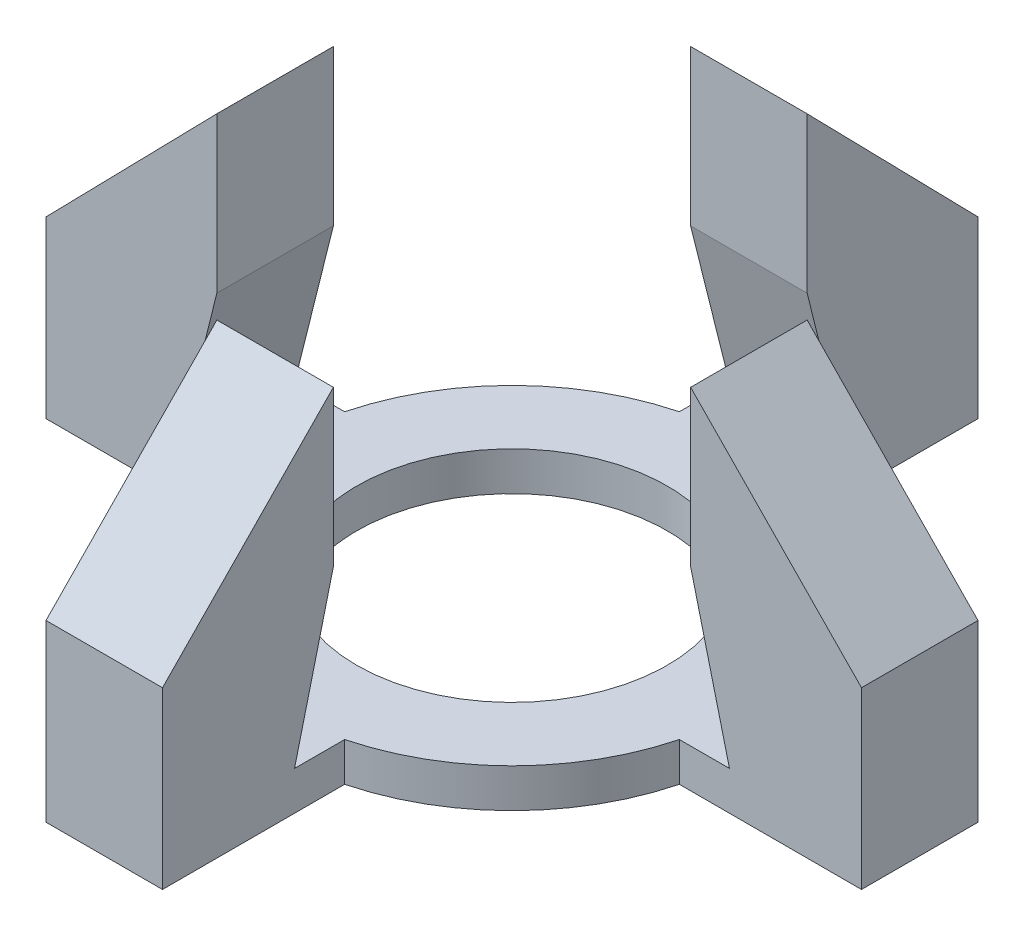
from build123d import *

# Parameters (mm, degrees)
EXTRUDE_1_DEPTH     = 5
SKETCH_4_W          = 22
SKETCH_4_H          = 15
SKETCH_4_W_2        = 15
SKETCH_4_H_2        = 22
EXTRUDE_3_DEPTH     = 40
CUT_EXTRUDE_1_REACH = 93.549
CUT_EXTRUDE_2_REACH = 93.549
CUT_EXTRUDE_3_REACH = 93.549
CUT_EXTRUDE_4_REACH = 93.549


with BuildPart() as part:
    # 草图1 → 凸台-拉伸1 (new body)
    with BuildSketch(Plane(origin=(0, 0, 0), x_dir=(1, 0, 0), z_dir=(0, 1, 0))):
        with BuildLine():
            ThreePointArc((29.047375097, 7.5), (21.213203436, 21.213203436), (7.5, 29.047375097))
            Line((7.5, 29.047375097), (7.5, 18.540496218))
            ThreePointArc((7.5, 18.540496218), (14.142135624, 14.142135624), (18.540496218, 7.5))
            Line((18.540496218, 7.5), (29.047375097, 7.5))
        make_face()
        with BuildLine():
            ThreePointArc((30, 0), (29.760890888, 3.780128774), (29.047375097, 7.5))
            Line((29.047375097, 7.5), (18.540496218, 7.5))
            ThreePointArc((18.540496218, 7.5), (19.63173355, 3.820345249), (20, 0))
            ThreePointArc((20, 0), (19.63173355, -3.820345249), (18.540496218, -7.5))
            Line((18.540496218, -7.5), (29.047375097, -7.5))
            ThreePointArc((29.047375097, -7.5), (29.760890888, -3.780128774), (30, 0))
        make_face()
        with BuildLine():
            Line((52.5, 7.5), (29.047375097, 7.5))
            ThreePointArc((29.047375097, 7.5), (29.760890888, 3.780128774), (30, 0))
            ThreePointArc((30, 0), (29.760890888, -3.780128774), (29.047375097, -7.5))
            Line((29.047375097, -7.5), (52.5, -7.5))
            Line((52.5, -7.5), (52.5, 7.5))
        make_face()
        with BuildLine():
            ThreePointArc((7.5, -29.047375097), (21.213203436, -21.213203436), (29.047375097, -7.5))
            Line((29.047375097, -7.5), (18.540496218, -7.5))
            ThreePointArc((18.540496218, -7.5), (14.142135624, -14.142135624), (7.5, -18.540496218))
            Line((7.5, -18.540496218), (7.5, -29.047375097))
        make_face()
        with BuildLine():
            ThreePointArc((7.5, -29.047375097), (0, -30), (-7.5, -29.047375097))
            Line((-7.5, -29.047375097), (-7.5, -52.5))
            Line((-7.5, -52.5), (7.5, -52.5))
            Line((7.5, -52.5), (7.5, -29.047375097))
        make_face()
        with BuildLine():
            Line((-7.5, -18.540496218), (-7.5, -29.047375097))
            ThreePointArc((-7.5, -29.047375097), (0, -30), (7.5, -29.047375097))
            Line((7.5, -29.047375097), (7.5, -18.540496218))
            ThreePointArc((7.5, -18.540496218), (0, -20), (-7.5, -18.540496218))
        make_face()
        with BuildLine():
            Line((-18.540496218, -7.5), (-29.047375097, -7.5))
            ThreePointArc((-29.047375097, -7.5), (-21.213203436, -21.213203436), (-7.5, -29.047375097))
            Line((-7.5, -29.047375097), (-7.5, -18.540496218))
            ThreePointArc((-7.5, -18.540496218), (-14.142135624, -14.142135624), (-18.540496218, -7.5))
        make_face()
        with BuildLine():
            Line((-18.540496218, 7.5), (-29.047375097, 7.5))
            ThreePointArc((-29.047375097, 7.5), (-30, 0), (-29.047375097, -7.5))
            Line((-29.047375097, -7.5), (-18.540496218, -7.5))
            ThreePointArc((-18.540496218, -7.5), (-20, 0), (-18.540496218, 7.5))
        make_face()
        with BuildLine():
            ThreePointArc((-29.047375097, -7.5), (-30, 0), (-29.047375097, 7.5))
            Line((-29.047375097, 7.5), (-52.5, 7.5))
            Line((-52.5, 7.5), (-52.5, -7.5))
            Line((-52.5, -7.5), (-29.047375097, -7.5))
        make_face()
        with BuildLine():
            Line((-7.5, 18.540496218), (-7.5, 29.047375097))
            ThreePointArc((-7.5, 29.047375097), (-21.213203436, 21.213203436), (-29.047375097, 7.5))
            Line((-29.047375097, 7.5), (-18.540496218, 7.5))
            ThreePointArc((-18.540496218, 7.5), (-14.142135624, 14.142135624), (-7.5, 18.540496218))
        make_face()
        with BuildLine():
            ThreePointArc((7.5, 29.047375097), (0, 30), (-7.5, 29.047375097))
            Line((-7.5, 29.047375097), (-7.5, 18.540496218))
            ThreePointArc((-7.5, 18.540496218), (0, 20), (7.5, 18.540496218))
            Line((7.5, 18.540496218), (7.5, 29.047375097))
        make_face()
        with BuildLine():
            Line((7.5, 52.5), (-7.5, 52.5))
            Line((-7.5, 52.5), (-7.5, 29.047375097))
            ThreePointArc((-7.5, 29.047375097), (0, 30), (7.5, 29.047375097))
            Line((7.5, 29.047375097), (7.5, 52.5))
        make_face()
    extrude(amount=EXTRUDE_1_DEPTH)

    # 草图4 → 凸台-拉伸3 (add)
    with BuildSketch(Plane(origin=(0, 5, 0), x_dir=(1, 0, 0), z_dir=(0, 1, 0))):
        with Locations((-41.5, 0)):
            Rectangle(SKETCH_4_W, SKETCH_4_H)
        with Locations((0, 41.5)):
            Rectangle(SKETCH_4_W_2, SKETCH_4_H_2)
        with Locations((41.5, 0)):
            Rectangle(SKETCH_4_W, SKETCH_4_H)
        with Locations((0, -41.5)):
            Rectangle(SKETCH_4_W_2, SKETCH_4_H_2)
    extrude(amount=EXTRUDE_3_DEPTH)

    # 草图5 → 切除-拉伸1 (cut, up to next)
    with BuildSketch(Plane.XY.offset(7.5), mode=Mode.PRIVATE) as cut_extrude_1_sk1:
        Polygon((-52.5, 22.5), (-30.5, 45), (-52.5, 45), align=None)
    cut_extrude_1_tool1 = extrude(cut_extrude_1_sk1.sketch, amount=-CUT_EXTRUDE_1_REACH, mode=Mode.PRIVATE) & part.part
    # 草图5 → 切除-拉伸1 (cut, up to next)
    with BuildSketch(Plane.XY.offset(7.5), mode=Mode.PRIVATE) as cut_extrude_1_sk2:
        Polygon((-35.5, 5), (-30.5, 5), (-30.5, 25), align=None)
    cut_extrude_1_tool2 = extrude(cut_extrude_1_sk2.sketch, amount=-CUT_EXTRUDE_1_REACH, mode=Mode.PRIVATE) & part.part
    add(cut_extrude_1_tool1.solids().sort_by_distance((-45.166667, 37.5, 7.5))[0], mode=Mode.SUBTRACT)
    add(cut_extrude_1_tool2.solids().sort_by_distance((-32.166667, 11.666667, 7.5))[0], mode=Mode.SUBTRACT)

    # 草图6 → 切除-拉伸2 (cut, up to next)
    with BuildSketch(Plane.ZY.offset(7.5), mode=Mode.PRIVATE) as cut_extrude_2_sk1:
        Polygon((-52.5, 22.5), (-30.5, 45), (-52.5, 45), align=None)
    cut_extrude_2_tool1 = extrude(cut_extrude_2_sk1.sketch, amount=-CUT_EXTRUDE_2_REACH, mode=Mode.PRIVATE) & part.part
    # 草图6 → 切除-拉伸2 (cut, up to next)
    with BuildSketch(Plane.ZY.offset(7.5), mode=Mode.PRIVATE) as cut_extrude_2_sk2:
        Polygon((-35.5, 5), (-30.5, 5), (-30.5, 25), align=None)
    cut_extrude_2_tool2 = extrude(cut_extrude_2_sk2.sketch, amount=-CUT_EXTRUDE_2_REACH, mode=Mode.PRIVATE) & part.part
    add(cut_extrude_2_tool1.solids().sort_by_distance((-7.5, 37.5, -45.166667))[0], mode=Mode.SUBTRACT)
    add(cut_extrude_2_tool2.solids().sort_by_distance((-7.5, 11.666667, -32.166667))[0], mode=Mode.SUBTRACT)

    # 草图7 → 切除-拉伸3 (cut, up to next)
    with BuildSketch(Plane(origin=(0, 0, -7.5), x_dir=(-1, 0, 0), z_dir=(0, 0, -1)), mode=Mode.PRIVATE) as cut_extrude_3_sk1:
        Polygon((-52.5, 22.5), (-30.5, 45), (-52.5, 45), align=None)
    cut_extrude_3_tool1 = extrude(cut_extrude_3_sk1.sketch, amount=-CUT_EXTRUDE_3_REACH, mode=Mode.PRIVATE) & part.part
    # 草图7 → 切除-拉伸3 (cut, up to next)
    with BuildSketch(Plane(origin=(0, 0, -7.5), x_dir=(-1, 0, 0), z_dir=(0, 0, -1)), mode=Mode.PRIVATE) as cut_extrude_3_sk2:
        Polygon((-35.5, 5), (-30.5, 5), (-30.5, 25), align=None)
    cut_extrude_3_tool2 = extrude(cut_extrude_3_sk2.sketch, amount=-CUT_EXTRUDE_3_REACH, mode=Mode.PRIVATE) & part.part
    add(cut_extrude_3_tool1.solids().sort_by_distance((45.166667, 37.5, -7.5))[0], mode=Mode.SUBTRACT)
    add(cut_extrude_3_tool2.solids().sort_by_distance((32.166667, 11.666667, -7.5))[0], mode=Mode.SUBTRACT)

    # 草图8 → 切除-拉伸4 (cut, up to next)
    with BuildSketch(Plane(origin=(7.5, 0, 0), x_dir=(0, 0, -1), z_dir=(1, 0, 0)), mode=Mode.PRIVATE) as cut_extrude_4_sk1:
        Polygon((-52.5, 22.5), (-30.5, 45), (-52.5, 45), align=None)
    cut_extrude_4_tool1 = extrude(cut_extrude_4_sk1.sketch, amount=-CUT_EXTRUDE_4_REACH, mode=Mode.PRIVATE) & part.part
    # 草图8 → 切除-拉伸4 (cut, up to next)
    with BuildSketch(Plane(origin=(7.5, 0, 0), x_dir=(0, 0, -1), z_dir=(1, 0, 0)), mode=Mode.PRIVATE) as cut_extrude_4_sk2:
        Polygon((-35.5, 5), (-30.5, 5), (-30.5, 25), align=None)
    cut_extrude_4_tool2 = extrude(cut_extrude_4_sk2.sketch, amount=-CUT_EXTRUDE_4_REACH, mode=Mode.PRIVATE) & part.part
    add(cut_extrude_4_tool1.solids().sort_by_distance((7.5, 37.5, 45.166667))[0], mode=Mode.SUBTRACT)
    add(cut_extrude_4_tool2.solids().sort_by_distance((7.5, 11.666667, 32.166667))[0], mode=Mode.SUBTRACT)


solid = part.part
